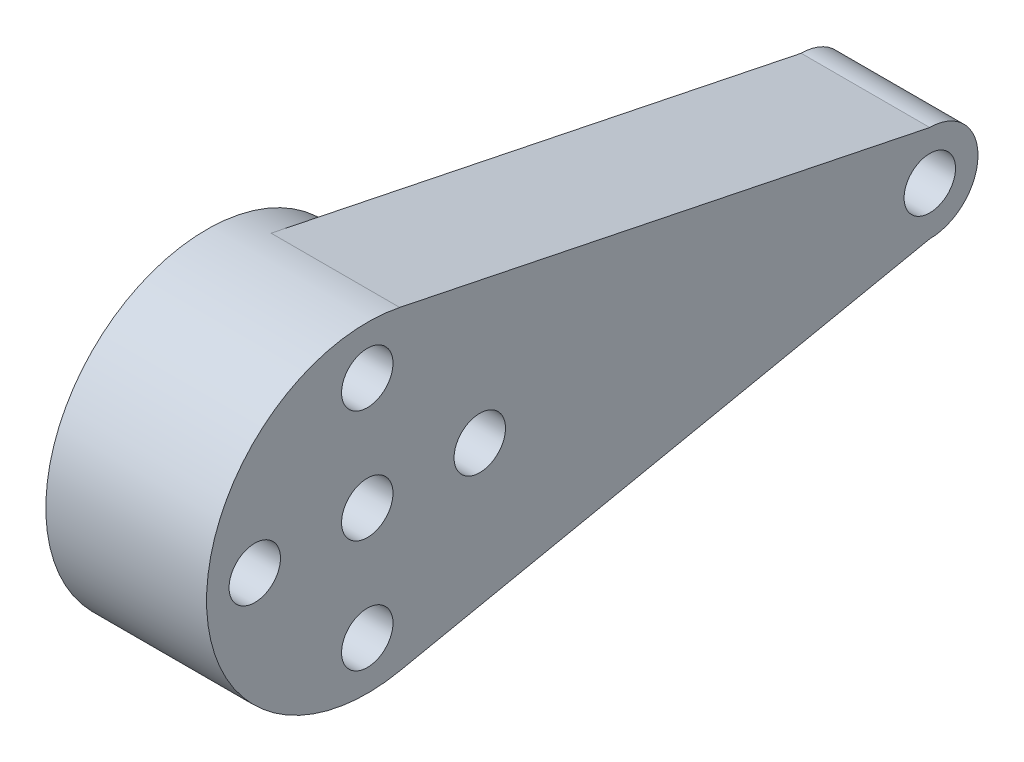
from build123d import *

# Parameters (mm, degrees)
ESQUISSE1_R             = 10
ESQUISSE1_R_2           = 1.6
BOSS_EXTRU_1_DEPTH      = 2
BOSS_EXTRU_2_DEPTH      = 8
BOSS_EXTRU_2_DEPTH_BACK = 0.0001
ESQUISSE2_R             = 10
ESQUISSE2_R_2           = 1.6
ESQUISSE2_R_3           = 3


with BuildPart() as part:
    # Esquisse1 → Boss.-Extru.1 (new body)
    with BuildSketch(Plane(origin=(0, 0, 0), x_dir=(0, 0, -1), z_dir=(1, 0, 0))):
        Circle(ESQUISSE1_R)
        with Locations((0, 7)):
            Circle(ESQUISSE1_R_2, mode=Mode.SUBTRACT)
        with Locations((7, 0)):
            Circle(ESQUISSE1_R_2, mode=Mode.SUBTRACT)
        with Locations((0, -7)):
            Circle(ESQUISSE1_R_2, mode=Mode.SUBTRACT)
        with Locations((-7, 0)):
            Circle(ESQUISSE1_R_2, mode=Mode.SUBTRACT)
        Circle(ESQUISSE1_R_2, mode=Mode.SUBTRACT)
    extrude(amount=BOSS_EXTRU_1_DEPTH)

    # Esquisse2 → Boss.-Extru.2 (add, two sides: drawn at the far end of the back side and taken through both)
    # profile 1 of 3: a face of its own
    with BuildSketch(Plane(origin=(2, 0, 0), x_dir=(0, 0, -1), z_dir=(1, 0, 0)).offset(-BOSS_EXTRU_2_DEPTH_BACK)):
        Circle(ESQUISSE2_R)
        Circle(ESQUISSE2_R_2, mode=Mode.SUBTRACT)
        with Locations((0, 7)):
            Circle(ESQUISSE2_R_2, mode=Mode.SUBTRACT)
        with Locations((-7, 0)):
            Circle(ESQUISSE2_R_2, mode=Mode.SUBTRACT)
        with Locations((7, 0)):
            Circle(ESQUISSE2_R_2, mode=Mode.SUBTRACT)
        with Locations((0, -7)):
            Circle(ESQUISSE2_R_2, mode=Mode.SUBTRACT)
    # profile 2 of 3: a face of its own
    with BuildSketch(Plane(origin=(2, 0, 0), x_dir=(0, 0, -1), z_dir=(1, 0, 0)).offset(-BOSS_EXTRU_2_DEPTH_BACK)):
        with BuildLine():
            Line((35, 3), (2.017627638, 9.794344221))
            ThreePointArc((2.017627638, 9.794344221), (7.7516539, 6.317583542), (10, 0))
            ThreePointArc((10, 0), (7.7516539, -6.317583542), (2.017627638, -9.794344221))
            Line((2.017627638, -9.794344221), (35, -3))
            ThreePointArc((35, -3), (32, 0), (35, 3))
        make_face()
    # profile 3 of 3: a face of its own
    with BuildSketch(Plane(origin=(2, 0, 0), x_dir=(0, 0, -1), z_dir=(1, 0, 0)).offset(-BOSS_EXTRU_2_DEPTH_BACK)):
        with Locations((35, 0)):
            Circle(ESQUISSE2_R_3)
        with Locations((35, 0)):
            Circle(ESQUISSE2_R_2, mode=Mode.SUBTRACT)
    extrude(amount=BOSS_EXTRU_2_DEPTH + BOSS_EXTRU_2_DEPTH_BACK)


solid = part.part
